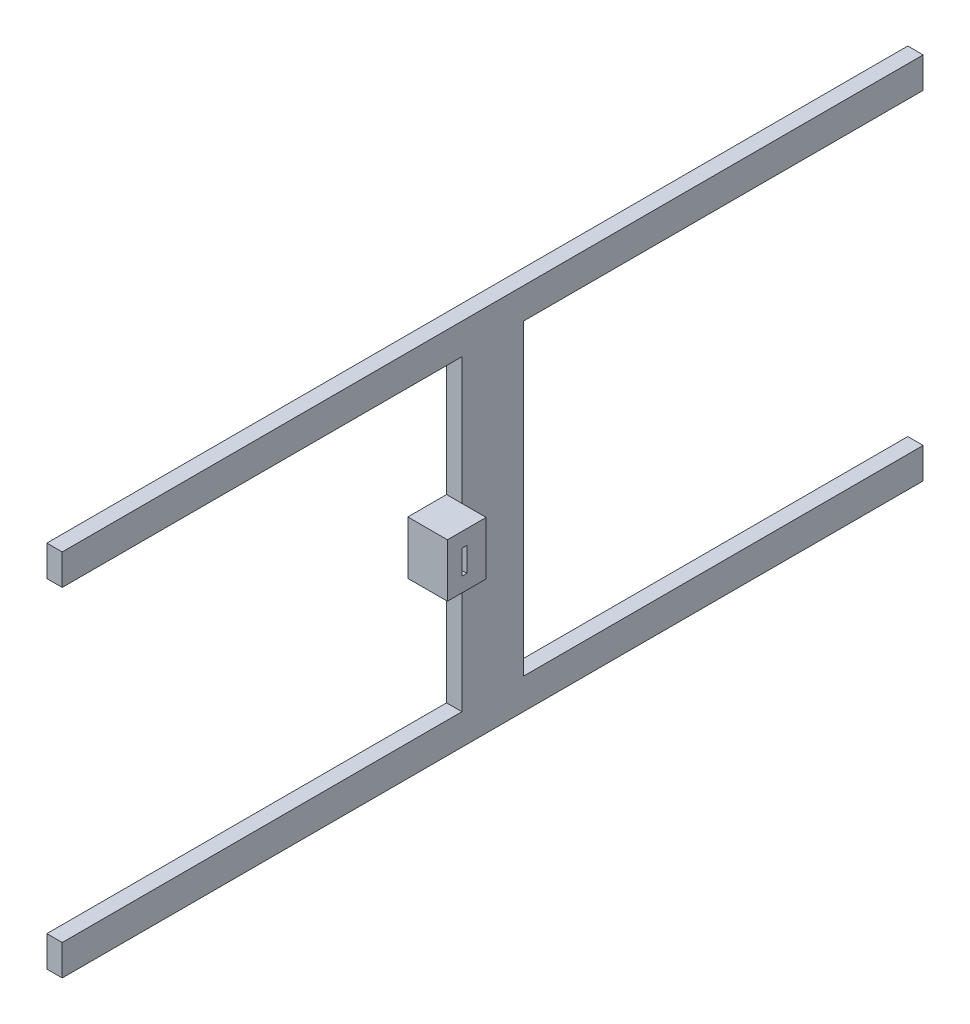
from build123d import *

# Parameters (mm, degrees)
BOSS_EXTRUDE1_DEPTH = 3.175
BOSS_EXTRUDE2_DEPTH = 5
SKETCH4_W           = 4
SKETCH4_H           = 5
BOSS_EXTRUDE3_DEPTH = 3.175


with BuildPart() as part:
    # Sketch1 → Boss-Extrude1 (new body)
    with BuildSketch(Plane(origin=(0, 0, 0), x_dir=(0, 0, -1), z_dir=(1, 0, 0))):
        Polygon((19.732226513, 31.75), (19.732226513, 0), (32.432226513, 0), (32.432226513, 31.75), (114.982226513, 31.75), (114.982226513, 38.1), (-62.817773487, 38.1), (-62.817773487, 31.75), align=None)
        Polygon((32.432226513, 0), (19.732226513, 0), (19.732226513, -31.75), (-62.817773487, -31.75), (-62.817773487, -38.1), (114.982226513, -38.1), (114.982226513, -31.75), (32.432226513, -31.75), align=None)
    extrude(amount=BOSS_EXTRUDE1_DEPTH)

    # Sketch2 → Boss-Extrude2 (add)
    with BuildSketch(Plane.ZY):
        Polygon((-19.732226513, 5.5), (-19.732226513, 2.5), (-14.732226513, 2.5), (-14.732226513, -2.5), (-19.732226513, -2.5), (-19.732226513, -5.5), (-11.732226513, -5.5), (-11.732226513, 5.5), align=None)
    extrude(amount=-BOSS_EXTRUDE2_DEPTH)

    # Sketch4 → Boss-Extrude3 (add)
    with BuildSketch(Plane(origin=(5, 0, 0), x_dir=(0, 0, -1), z_dir=(1, 0, 0))):
        Polygon((11.732226513, 5.5), (11.732226513, -5.5), (19.732226513, -5.5), (19.732226513, -2.5), (14.732226513, -2.5), (14.732226513, 2.5), (19.732226513, 2.5), (19.732226513, 5.5), align=None)
        with Locations((17.732226513, 0)):
            Rectangle(SKETCH4_W, SKETCH4_H)
    extrude(amount=BOSS_EXTRUDE3_DEPTH)


solid = part.part
